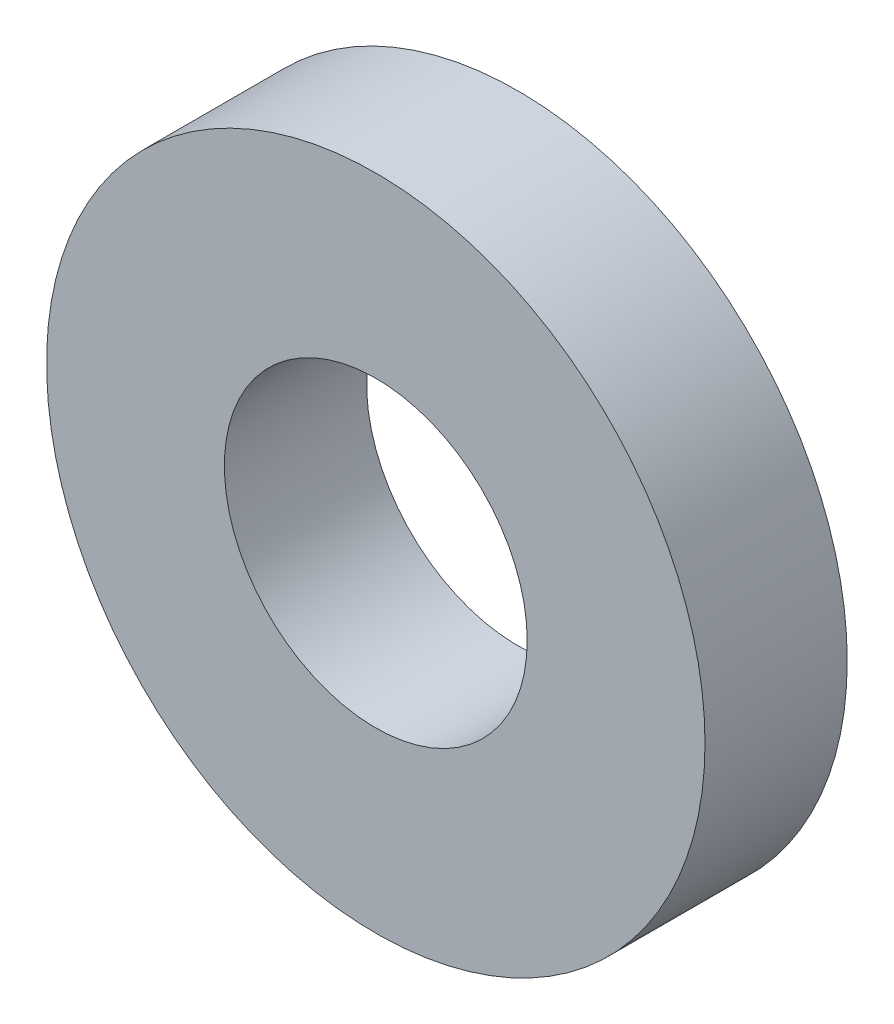
from build123d import *

# Parameters (mm, degrees)
SKETCH1_R      = 6.35
SKETCH1_R_2    = 2.921
EXTRUDE1_DEPTH = 2.7432


with BuildPart() as part:
    # Sketch1 → Extrude1 (new body)
    with BuildSketch(Plane.XY):
        Circle(SKETCH1_R)
        Circle(SKETCH1_R_2, mode=Mode.SUBTRACT)
    extrude(amount=-EXTRUDE1_DEPTH)


solid = part.part
